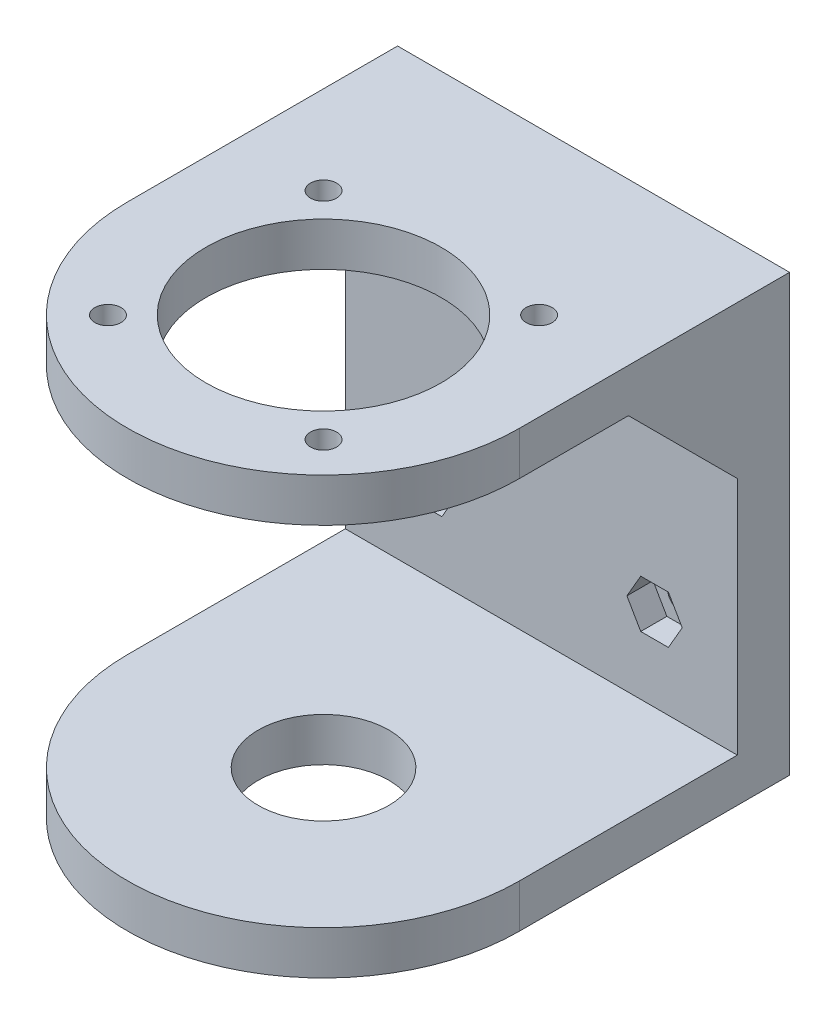
from build123d import *

# Parameters (mm, degrees)
SKETCH_1_R          = 1.5
SKETCH_1_R_2        = 13.5
EXTRUDE_1_DEPTH     = 5
SKETCH_2_W          = 45
SKETCH_2_H          = 6
EXTRUDE_2_DEPTH     = 45
CUT_EXTRUDE_1_REACH = 82.543
SKETCH_4_R          = 1.5
EXTRUDE_3_DEPTH     = 3
EXTRUDE_4_DEPTH     = 3
FILLET_1_R          = 1
CUT_EXTRUDE_2_DEPTH = 3
EXTRUDE_START       = 5
EXTRUDE_5_DEPTH     = 5
CUT_EXTRUDE_3_REACH = 85.14
SKETCH_9_R          = 7.5


with BuildPart() as part:
    # 草图1 → 凸台-拉伸1 (new body)
    with BuildSketch(Plane(origin=(0, 0, 0), x_dir=(1, 0, 0), z_dir=(0, 1, 0))):
        with BuildLine():
            ThreePointArc((0, 22.5), (6.590097423, 6.590097423), (22.5, 0))
            ThreePointArc((22.5, 0), (38.409902577, 6.590097423), (45, 22.5))
            Line((45, 22.5), (45, 47.5))
            Line((45, 47.5), (0, 47.5))
            Line((0, 47.5), (0, 22.5))
        make_face()
        with Locations(Location((10.125, 10.125, 0), (0, 0, 270))):
            Circle(SKETCH_1_R, mode=Mode.SUBTRACT)
        with Locations(Location((34.875, 10.125, 0), (0, 0, 270))):
            Circle(SKETCH_1_R, mode=Mode.SUBTRACT)
        with Locations(Location((22.5, 22.5, 0), (0, 0, 270))):
            Circle(SKETCH_1_R_2, mode=Mode.SUBTRACT)
        with Locations(Location((10.125, 34.875, 0), (0, 0, 270))):
            Circle(SKETCH_1_R, mode=Mode.SUBTRACT)
        with Locations(Location((34.875, 34.875, 0), (0, 0, 270))):
            Circle(SKETCH_1_R, mode=Mode.SUBTRACT)
    extrude(amount=EXTRUDE_1_DEPTH)

    # 草图2 → 凸台-拉伸2 (add)
    with BuildSketch(Plane(origin=(0, 5, 0), x_dir=(1, 0, 0), z_dir=(0, 1, 0))):
        with Locations((22.5, 50.5)):
            Rectangle(SKETCH_2_W, SKETCH_2_H)
    extrude(amount=-EXTRUDE_2_DEPTH)

    # 草图4 → 切除-拉伸1 (cut, up to next)
    with BuildSketch(Plane(origin=(0, 0, -53.5), x_dir=(-1, 0, 0), z_dir=(0, 0, -1)), mode=Mode.PRIVATE) as cut_extrude_1_sk1:
        with Locations((-9.5, -4.5)):
            Circle(SKETCH_4_R)
    cut_extrude_1_tool1 = extrude(cut_extrude_1_sk1.sketch, amount=-CUT_EXTRUDE_1_REACH, mode=Mode.PRIVATE) & part.part
    # 草图4 → 切除-拉伸1 (cut, up to next)
    with BuildSketch(Plane(origin=(0, 0, -53.5), x_dir=(-1, 0, 0), z_dir=(0, 0, -1)), mode=Mode.PRIVATE) as cut_extrude_1_sk2:
        with Locations((-9.5, -30.5)):
            Circle(SKETCH_4_R)
    cut_extrude_1_tool2 = extrude(cut_extrude_1_sk2.sketch, amount=-CUT_EXTRUDE_1_REACH, mode=Mode.PRIVATE) & part.part
    # 草图4 → 切除-拉伸1 (cut, up to next)
    with BuildSketch(Plane(origin=(0, 0, -53.5), x_dir=(-1, 0, 0), z_dir=(0, 0, -1)), mode=Mode.PRIVATE) as cut_extrude_1_sk3:
        with Locations((-35.5, -30.5)):
            Circle(SKETCH_4_R)
    cut_extrude_1_tool3 = extrude(cut_extrude_1_sk3.sketch, amount=-CUT_EXTRUDE_1_REACH, mode=Mode.PRIVATE) & part.part
    # 草图4 → 切除-拉伸1 (cut, up to next)
    with BuildSketch(Plane(origin=(0, 0, -53.5), x_dir=(-1, 0, 0), z_dir=(0, 0, -1)), mode=Mode.PRIVATE) as cut_extrude_1_sk4:
        with Locations((-35.5, -4.5)):
            Circle(SKETCH_4_R)
    cut_extrude_1_tool4 = extrude(cut_extrude_1_sk4.sketch, amount=-CUT_EXTRUDE_1_REACH, mode=Mode.PRIVATE) & part.part
    add(cut_extrude_1_tool1.solids().sort_by_distance((9.5, -4.5, -53.5))[0], mode=Mode.SUBTRACT)
    add(cut_extrude_1_tool2.solids().sort_by_distance((9.5, -30.5, -53.5))[0], mode=Mode.SUBTRACT)
    add(cut_extrude_1_tool3.solids().sort_by_distance((35.5, -30.5, -53.5))[0], mode=Mode.SUBTRACT)
    add(cut_extrude_1_tool4.solids().sort_by_distance((35.5, -4.5, -53.5))[0], mode=Mode.SUBTRACT)

    # 草图5 → 凸台-拉伸3 (add)
    with BuildSketch(Plane.ZY):
        Polygon((-47.5, 0), (-35, 0), (-47.5, -12.5), align=None)
    extrude(amount=-EXTRUDE_3_DEPTH)

    # 草图6 → 凸台-拉伸4 (add)
    with BuildSketch(Plane(origin=(45, 0, 0), x_dir=(0, 0, -1), z_dir=(1, 0, 0))):
        Polygon((35, 0), (47.5, 0), (47.5, -12.5), align=None)
    extrude(amount=-EXTRUDE_4_DEPTH)

    # 圆角1
    fillet_1_edges = [part.edges().sort_by_distance(p)[0] for p in [
        (22.5, 0, -47.5),
    ]]
    fillet(fillet_1_edges, radius=FILLET_1_R)

    # 草图7 → 切除-拉伸2 (cut)
    with BuildSketch(Plane.XY.offset(-47.5)):
        Polygon((11.08771324, -33.25), (7.91228676, -33.25), (6.324573519, -30.5), (7.91228676, -27.75), (11.08771324, -27.75), (12.675426481, -30.5), align=None)
        Polygon((37.08771324, -33.25), (38.675426481, -30.5), (37.08771324, -27.75), (33.91228676, -27.75), (32.324573519, -30.5), (33.91228676, -33.25), align=None)
        Polygon((33.91228676, -1.75), (37.08771324, -1.75), (38.675426481, -4.5), (37.08771324, -7.25), (33.91228676, -7.25), (32.324573519, -4.5), align=None)
        Polygon((7.91228676, -1.75), (6.324573519, -4.5), (7.91228676, -7.25), (11.08771324, -7.25), (12.675426481, -4.5), (11.08771324, -1.75), align=None)
    extrude(amount=-CUT_EXTRUDE_2_DEPTH, mode=Mode.SUBTRACT)

    # 草图8 → 凸台-拉伸5 (add)
    with BuildSketch(Plane(origin=(0, -40, 0), x_dir=(-1, 0, 0), z_dir=(0, -1, 0)).offset(EXTRUDE_START)):
        with BuildLine():
            Line((-45, 53.5), (-45, 22.5))
            ThreePointArc((-45, 22.5), (-22.5, 0), (0, 22.5))
            Line((0, 22.5), (0, 53.5))
            Line((0, 53.5), (-45, 53.5))
        make_face()
    extrude(amount=-EXTRUDE_5_DEPTH)

    # 草图9 → 切除-拉伸3 (cut, up to next)
    with BuildSketch(Plane(origin=(0, -40, 0), x_dir=(-1, 0, 0), z_dir=(0, -1, 0)), mode=Mode.PRIVATE) as cut_extrude_3_sk1:
        with Locations(Location((-22.5, 22.5, 0), (0, 0, 90))):
            Circle(SKETCH_9_R)
    cut_extrude_3_tool1 = extrude(cut_extrude_3_sk1.sketch, amount=CUT_EXTRUDE_3_REACH, mode=Mode.PRIVATE) & part.part
    add(cut_extrude_3_tool1.solids().sort_by_distance((22.5, -40, -22.5))[0], mode=Mode.SUBTRACT)


solid = part.part
